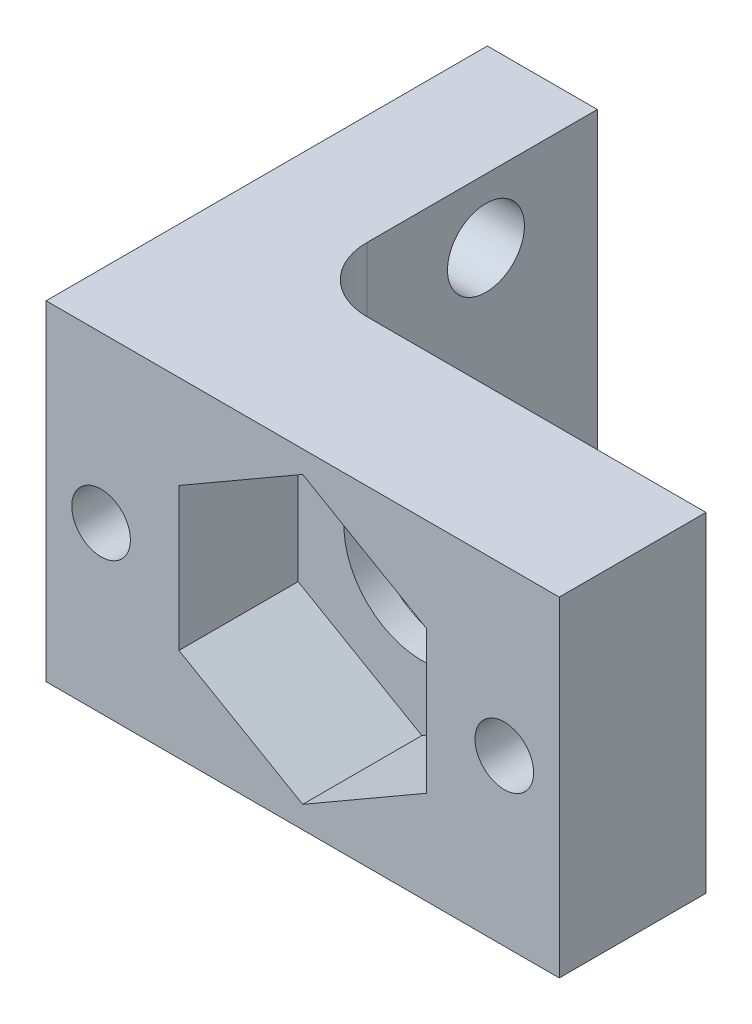
from build123d import *

# Parameters (mm, degrees)
BOSS_EXTRUDE1_DEPTH = 18
CUT_EXTRUDE1_DEPTH  = 6.5
SKETCH4_R           = 1.6
CUT_EXTRUDE2_DEPTH  = 17
SKETCH5_W           = 2
SKETCH5_H           = 6
CUT_EXTRUDE3_DEPTH  = 6
SKETCH6_R           = 4.25
CUT_EXTRUDE4_DEPTH  = 6
FILLET1_R           = 3.5
SKETCH7_R           = 2.1
CUT_EXTRUDE5_DEPTH  = 6


with BuildPart() as part:
    # Sketch1 → Boss-Extrude1 (new body)
    with BuildSketch(Plane(origin=(0, 0, 0), x_dir=(1, 0, 0), z_dir=(0, 1, 0))):
        Polygon((0, 24.076190476), (0, 0), (28, 0), (28, 8), (6, 8), (6, 24.076190476), align=None)
    extrude(amount=BOSS_EXTRUDE1_DEPTH)

    # Sketch3 → Cut-Extrude1 (cut)
    with BuildSketch(Plane.XY):
        Polygon((20.75, 5.102885683), (20.75, 12.897114317), (14, 16.794228634), (7.25, 12.897114317), (7.25, 5.102885683), (14, 1.205771366), align=None)
    extrude(amount=-CUT_EXTRUDE1_DEPTH, mode=Mode.SUBTRACT)

    # Sketch4 → Cut-Extrude2 (cut)
    with BuildSketch(Plane.XY):
        with Locations((25, 9)):
            Circle(SKETCH4_R)
        with Locations((3, 9)):
            Circle(SKETCH4_R)
    extrude(amount=-CUT_EXTRUDE2_DEPTH, mode=Mode.SUBTRACT)

    # Sketch5 → Cut-Extrude3 (cut)
    with BuildSketch(Plane.ZY):
        with Locations((-13, 9)):
            Rectangle(SKETCH5_W, SKETCH5_H)
    extrude(amount=-CUT_EXTRUDE3_DEPTH, mode=Mode.SUBTRACT)

    # Sketch6 → Cut-Extrude4 (cut)
    with BuildSketch(Plane.XY.offset(-6.5)):
        with Locations((14, 9)):
            Circle(SKETCH6_R)
    extrude(amount=-CUT_EXTRUDE4_DEPTH, mode=Mode.SUBTRACT)

    # Fillet1
    fillet1_edges = [part.edges().sort_by_distance(p)[0] for p in [
        (6, 9, -8),
    ]]
    fillet(fillet1_edges, radius=FILLET1_R)

    # Sketch7 → Cut-Extrude5 (cut)
    with BuildSketch(Plane(origin=(6, 0, 0), x_dir=(0, 0, -1), z_dir=(1, 0, 0))):
        with Locations((18, 14.5)):
            Circle(SKETCH7_R)
        with Locations(Location((18, 3.5, 0), (0, 0, 180))):
            Circle(SKETCH7_R)
    extrude(amount=-CUT_EXTRUDE5_DEPTH, mode=Mode.SUBTRACT)


solid = part.part
